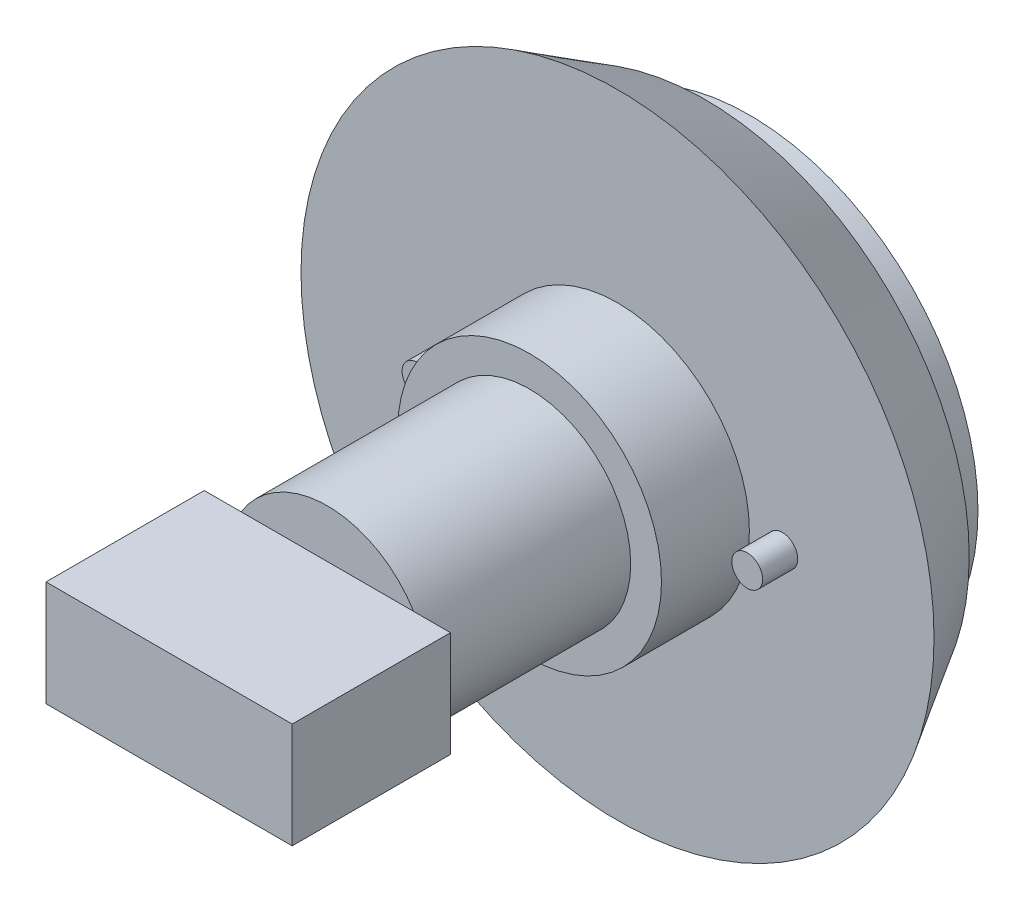
from build123d import *

# Parameters (mm, degrees)
SKETCH1_R           = 26
BOSS_EXTRUDE1_DEPTH = 15
SKETCH3_R           = 15
BOSS_EXTRUDE2_DEPTH = 10
SKETCH4_R           = 11.5
BOSS_EXTRUDE3_DEPTH = 23
SKETCH5_W           = 28
SKETCH5_H           = 12
BOSS_EXTRUDE4_DEPTH = 18
SKETCH6_R           = 1.75
BOSS_EXTRUDE5_DEPTH = 4


with BuildPart() as part:
    # Sketch1 → Boss-Extrude1 (new body)
    with BuildSketch(Plane.XY):
        Circle(SKETCH1_R)
    extrude(amount=BOSS_EXTRUDE1_DEPTH)

    # Sketch2 → Revolve1 (revolve)
    with BuildSketch(Plane(origin=(0, 0, 0), x_dir=(1, 0, 0), z_dir=(0, 1, 0))):
        Polygon((26, -15), (36, -15), (30, -5), (26, -5), align=None)
    revolve(axis=Axis((0, 0, 15), (0, 0, -1)))

    # Sketch3 → Boss-Extrude2 (add)
    with BuildSketch(Plane.XY.offset(15)):
        Circle(SKETCH3_R)
    extrude(amount=BOSS_EXTRUDE2_DEPTH)

    # Sketch4 → Boss-Extrude3 (add)
    with BuildSketch(Plane.XY.offset(25)):
        Circle(SKETCH4_R)
    extrude(amount=BOSS_EXTRUDE3_DEPTH)

    # Sketch5 → Boss-Extrude4 (add)
    with BuildSketch(Plane.XY.offset(48)):
        Rectangle(SKETCH5_W, SKETCH5_H)
    extrude(amount=BOSS_EXTRUDE4_DEPTH)

    # Sketch6 → Boss-Extrude5 (add)
    with BuildSketch(Plane.XY.offset(15)):
        with Locations((-18.75, 0)):
            Circle(SKETCH6_R)
        with Locations(Location((18.75, 0, 0), (0, 0, 180))):
            Circle(SKETCH6_R)
    extrude(amount=BOSS_EXTRUDE5_DEPTH)


solid = part.part
